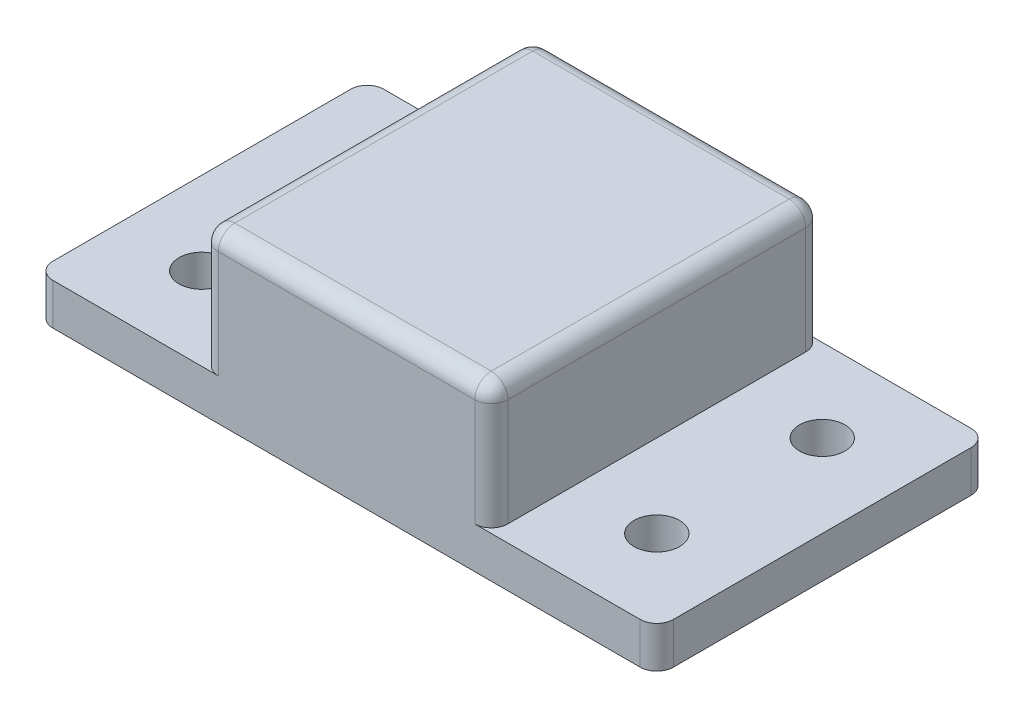
from build123d import *

# Parameters (mm, degrees)
SKETCH1_W                      = 75
SKETCH1_H                      = 40
BOSS_EXTRUDE1_DEPTH            = 5
SKETCH3_W                      = 35
SKETCH3_H                      = 40
BOSS_EXTRUDE2_DEPTH            = 15
FILLET1_R                      = 2
FILLET2_R                      = 2
M5_CLEARANCE_HOLE1_D           = 5.5
M5_CLEARANCE_HOLE1_CSINK_D     = 5.55
M5_CLEARANCE_HOLE1_CSINK_ANGLE = 90


with BuildPart() as part:
    # Sketch1 → Boss-Extrude1 (new body)
    with BuildSketch(Plane(origin=(0, 0, 0), x_dir=(1, 0, 0), z_dir=(0, 1, 0))):
        Rectangle(SKETCH1_W, SKETCH1_H)
    extrude(amount=BOSS_EXTRUDE1_DEPTH)

    # Sketch3 → Boss-Extrude2 (add)
    with BuildSketch(Plane(origin=(0, 5, 0), x_dir=(1, 0, 0), z_dir=(0, 1, 0))):
        Rectangle(SKETCH3_W, SKETCH3_H)
    extrude(amount=BOSS_EXTRUDE2_DEPTH)

    # Fillet1
    fillet1_edges = [part.edges().sort_by_distance(p)[0] for p in [
        (-37.5, 2.5, -20),
        (-37.5, 2.5, 20),
        (37.5, 2.5, 20),
        (37.5, 2.5, -20),
    ]]
    fillet(fillet1_edges, radius=FILLET1_R)

    # Fillet2
    fillet2_edges = [part.edges().sort_by_distance(p)[0] for p in [
        (17.5, 12.5, 20),
        (17.5, 12.5, -20),
        (-17.5, 12.5, -20),
        (-17.5, 12.5, 20),
        (17.5, 20, 0),
        (0, 20, -20),
        (-17.5, 20, 0),
        (0, 20, 20),
    ]]
    fillet(fillet2_edges, radius=FILLET2_R)

    # M5 Clearance Hole1 (through all)
    with Locations(Plane(origin=(-27.5, 0, 10), x_dir=(0, 0, -1), z_dir=(0, -1, 0))):
        with Locations((0, 0), (20, 0)):
            m5_clearance_hole1 = CounterSinkHole(M5_CLEARANCE_HOLE1_D / 2, M5_CLEARANCE_HOLE1_CSINK_D / 2, counter_sink_angle=M5_CLEARANCE_HOLE1_CSINK_ANGLE)

    # Mirror1: M5 Clearance Hole1 across plane
    add(m5_clearance_hole1.mirror(Plane(origin=(0, 0, 0), x_dir=(0, 0, 1), z_dir=(1, 0, 0))), mode=Mode.SUBTRACT)


solid = part.part
